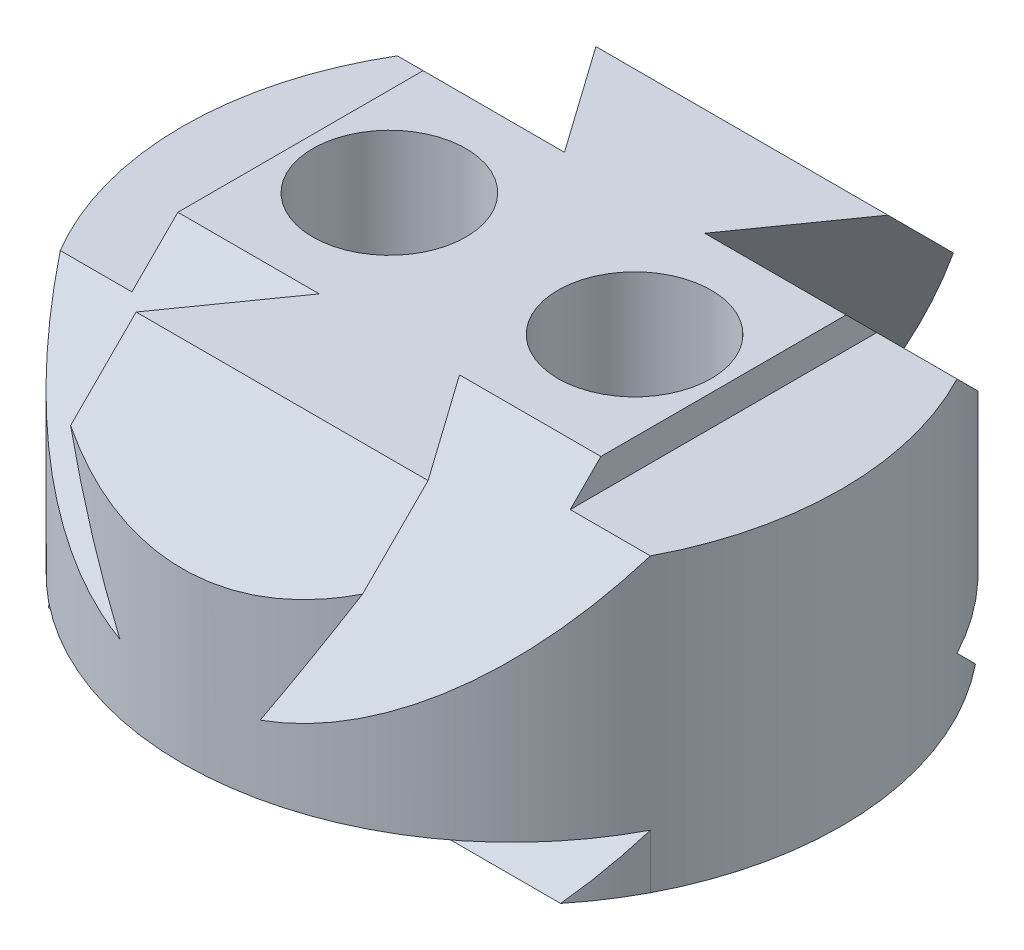
from build123d import *

# Parameters (mm, degrees)
SKETCH1_R                             = 21.5
BOSS_EXTRUDE1_DEPTH                   = 4
SKETCH2_R                             = 5.875
BOSS_EXTRUDE2_DEPTH                   = 65
BOSS_EXTRUDE3_REACH                   = 73.76
BOSS_EXTRUDE3_END_RADIUS              = 21.5
BOSS_EXTRUDE3_DIRECTION_2_REACH       = 73.76
BOSS_EXTRUDE3_DIRECTION_2_END_RADIUS  = 21.5
BOSS_EXTRUDE12_REACH                  = 71.147
BOSS_EXTRUDE12_END_RADIUS             = 21.5
BOSS_EXTRUDE13_REACH                  = 71.147
BOSS_EXTRUDE13_END_RADIUS             = 21.5
CUT_EXTRUDE3_DEPTH                    = 10
CUT_EXTRUDE3_DEPTH_BACK               = 2
SKETCH14_OUTSIDE_W                    = 63.394
SKETCH14_OUTSIDE_H                    = 63.394
SKETCH14_OUTSIDE_R                    = 5.875
SKETCH29_R                            = 7.508109265
CUT_EXTRUDE9_DEPTH                    = 51.5
SKETCH30_R                            = 5
CUT_EXTRUDE10_DEPTH                   = 9.8
CUT_EXTRUDE13_DEPTH                   = 38.426594822
CUT_EXTRUDE13_DEPTH_BACK              = 38.426594822
SKETCH31_W                            = 7.7
SKETCH31_H                            = 2
SKETCH31_H_2                          = 3
BOSS_EXTRUDE14_REACH                  = 35.268
BOSS_EXTRUDE14_END_RADIUS             = 21.5
BOSS_EXTRUDE14_DIRECTION_2_REACH      = 35.268
BOSS_EXTRUDE14_DIRECTION_2_END_RADIUS = 21.5
CUT_EXTRUDE14_START                   = -3
SKETCH36_R                            = 5
CUT_EXTRUDE14_DEPTH                   = 3
CUT_EXTRUDE15_REACH                   = 37.352
SKETCH38_R                            = 1.8923


with BuildPart() as part:
    # Sketch1 → Boss-Extrude1 (new body)
    with BuildSketch(Plane(origin=(0, 0, 0), x_dir=(1, 0, 0), z_dir=(0, 1, 0))):
        with Locations(Location((0, 0, 0), (0, 0, 270))):
            Circle(SKETCH1_R)
    extrude(amount=-BOSS_EXTRUDE1_DEPTH)

    # Sketch2 → Boss-Extrude2 (add)
    with BuildSketch(Plane(origin=(0, 0, 0), x_dir=(1, 0, 0), z_dir=(0, 1, 0))):
        with Locations(Location((0, 0, 0), (0, 0, 270))):
            Circle(SKETCH2_R)
    extrude(amount=BOSS_EXTRUDE2_DEPTH)

    # Boss-Extrude3: up to this cylinder (the profile starts inside it)
    boss_extrude3_end = Plane(origin=(0, 6.293939, 0), z_dir=(0, 1, 0)) * Cylinder(BOSS_EXTRUDE3_END_RADIUS, 191.52, mode=Mode.PRIVATE)
    # Sketch5 → Boss-Extrude3 (add, up to the surface)
    with BuildSketch(Plane(origin=(0, 0, 0), x_dir=(0, 0, -1), z_dir=(1, 0, 0)), mode=Mode.PRIVATE) as boss_extrude3_sk1:
        Polygon((21.5, 0), (0, 0), (-21.5, 0), (-6, 15.5), (6, 15.5), align=None)
    boss_extrude3_tool1 = extrude(boss_extrude3_sk1.sketch, amount=BOSS_EXTRUDE3_REACH, mode=Mode.PRIVATE) & boss_extrude3_end
    add(boss_extrude3_tool1.solids().sort_by_distance((0, 6.293939, 0))[0])

    # Boss-Extrude3 direction 2: up to this cylinder (the profile starts inside it)
    boss_extrude3_direction_2_end = Plane(origin=(0, 6.293939, 0), z_dir=(0, 1, 0)) * Cylinder(BOSS_EXTRUDE3_DIRECTION_2_END_RADIUS, 191.52, mode=Mode.PRIVATE)
    # Sketch5 → Boss-Extrude3 direction 2 (add, up to the surface)
    with BuildSketch(Plane(origin=(0, 0, 0), x_dir=(0, 0, -1), z_dir=(1, 0, 0)), mode=Mode.PRIVATE) as boss_extrude3_direction_2_sk1:
        Polygon((21.5, 0), (0, 0), (-21.5, 0), (-6, 15.5), (6, 15.5), align=None)
    boss_extrude3_direction_2_tool1 = extrude(boss_extrude3_direction_2_sk1.sketch, amount=-BOSS_EXTRUDE3_DIRECTION_2_REACH, mode=Mode.PRIVATE) & boss_extrude3_direction_2_end
    add(boss_extrude3_direction_2_tool1.solids().sort_by_distance((0, 6.293939, 0))[0])

    # Boss-Extrude12: up to this cylinder (the profile starts inside it)
    boss_extrude12_end = Plane(origin=(0, 17.454773, 0), z_dir=(0, 1, 0)) * Cylinder(BOSS_EXTRUDE12_END_RADIUS, 186.294, mode=Mode.PRIVATE)
    # Sketch6 → Boss-Extrude12 (add, up to the surface)
    with BuildSketch(Plane(origin=(0, 4.75, 4.75), x_dir=(-1, 0, 0), z_dir=(0, -0.7071067811865432, -0.7071067811865518)), mode=Mode.PRIVATE) as boss_extrude12_sk1:
        Polygon((0, 15.202795796), (4.575252532, 15.202795796), (9.525, 20.152543264), (0, 20.152543264), (-9.525, 20.152543264), (-4.575252532, 15.202795796), align=None)
    boss_extrude12_tool1 = extrude(boss_extrude12_sk1.sketch, amount=BOSS_EXTRUDE12_REACH, mode=Mode.PRIVATE) & boss_extrude12_end
    add(boss_extrude12_tool1.solids().sort_by_distance((0, 17.454773, -7.954773))[0])

    # Boss-Extrude13: up to this cylinder (the profile starts inside it)
    boss_extrude13_end = Plane(origin=(0, 17.454773, 0), z_dir=(0, 1, 0)) * Cylinder(BOSS_EXTRUDE13_END_RADIUS, 186.294, mode=Mode.PRIVATE)
    # Sketch10 → Boss-Extrude13 (add, up to the surface)
    with BuildSketch(Plane(origin=(0, 4.75, -4.75), x_dir=(-1, 0, 0), z_dir=(0, 0.7071067811865476, -0.7071067811865475)), mode=Mode.PRIVATE) as boss_extrude13_sk1:
        Polygon((0, 15.202795796), (-4.575252532, 15.202795796), (-9.525, 20.152543264), (0, 20.152543264), (9.525, 20.152543264), (4.575252532, 15.202795796), align=None)
    boss_extrude13_tool1 = extrude(boss_extrude13_sk1.sketch, amount=-BOSS_EXTRUDE13_REACH, mode=Mode.PRIVATE) & boss_extrude13_end
    add(boss_extrude13_tool1.solids().sort_by_distance((0, 17.454773, 7.954773))[0])

    # Sketch14 outside → Cut-Extrude3 (cut, two sides: drawn at the far end of the back side and taken through both)
    with BuildSketch(Plane(origin=(0, 15.5, 0), x_dir=(1, 0, 0), z_dir=(0, 1, 0)).offset(-CUT_EXTRUDE3_DEPTH_BACK)):
        Rectangle(SKETCH14_OUTSIDE_W, SKETCH14_OUTSIDE_H)
        with Locations(Location((0, 0, 0), (0, 0, 270))):
            Circle(SKETCH14_OUTSIDE_R, mode=Mode.SUBTRACT)
    extrude(amount=CUT_EXTRUDE3_DEPTH + CUT_EXTRUDE3_DEPTH_BACK, mode=Mode.SUBTRACT)

    # Sketch29 → Cut-Extrude9 (cut)
    with BuildSketch(Plane(origin=(0, 65, 0), x_dir=(1, 0, 0), z_dir=(0, 1, 0))):
        Circle(SKETCH29_R)
    extrude(amount=-CUT_EXTRUDE9_DEPTH, mode=Mode.SUBTRACT)

    # Sketch30 → Cut-Extrude10 (cut)
    with BuildSketch(Plane(origin=(0, 13.5, 0), x_dir=(1, 0, 0), z_dir=(0, 1, 0))):
        with Locations(Location((-8, 0, 0), (0, 0, 270))):
            Circle(SKETCH30_R)
        with Locations(Location((8, 0, 0), (0, 0, 270))):
            Circle(SKETCH30_R)
    extrude(amount=-CUT_EXTRUDE10_DEPTH, mode=Mode.SUBTRACT)

    # Sketch31 → Cut-Extrude13 (cut, two sides: drawn at the far end of the back side and taken through both)
    with BuildSketch(Plane.XY.offset(-6).offset(-CUT_EXTRUDE13_DEPTH_BACK)):
        with Locations((17.65, 12.5)):
            Rectangle(SKETCH31_W, SKETCH31_H)
        with Locations((-17.65, 12)):
            Rectangle(SKETCH31_W, SKETCH31_H_2)
    extrude(amount=CUT_EXTRUDE13_DEPTH + CUT_EXTRUDE13_DEPTH_BACK, mode=Mode.SUBTRACT)

    # Boss-Extrude14: up to this cylinder (the profile starts inside it)
    boss_extrude14_end = Plane(origin=(0, -5.856286, 0), z_dir=(0, 1, 0)) * Cylinder(BOSS_EXTRUDE14_END_RADIUS, 114.536, mode=Mode.PRIVATE)
    # Sketch34 → Boss-Extrude14 (add, up to the surface)
    with BuildSketch(Plane(origin=(0, 0, 0), x_dir=(0, 0, -1), z_dir=(1, 0, 0)), mode=Mode.PRIVATE) as boss_extrude14_sk1:
        Polygon((0, -4), (-10, -4), (-13.535533906, -7.535533906), (13.535533906, -7.535533906), (10, -4), align=None)
    boss_extrude14_tool1 = extrude(boss_extrude14_sk1.sketch, amount=BOSS_EXTRUDE14_REACH, mode=Mode.PRIVATE) & boss_extrude14_end
    add(boss_extrude14_tool1.solids().sort_by_distance((0, -5.856286, 0))[0])

    # Boss-Extrude14 direction 2: up to this cylinder (the profile starts inside it)
    boss_extrude14_direction_2_end = Plane(origin=(0, -5.856286, 0), z_dir=(0, 1, 0)) * Cylinder(BOSS_EXTRUDE14_DIRECTION_2_END_RADIUS, 114.536, mode=Mode.PRIVATE)
    # Sketch34 → Boss-Extrude14 direction 2 (add, up to the surface)
    with BuildSketch(Plane(origin=(0, 0, 0), x_dir=(0, 0, -1), z_dir=(1, 0, 0)), mode=Mode.PRIVATE) as boss_extrude14_direction_2_sk1:
        Polygon((0, -4), (-10, -4), (-13.535533906, -7.535533906), (13.535533906, -7.535533906), (10, -4), align=None)
    boss_extrude14_direction_2_tool1 = extrude(boss_extrude14_direction_2_sk1.sketch, amount=-BOSS_EXTRUDE14_DIRECTION_2_REACH, mode=Mode.PRIVATE) & boss_extrude14_direction_2_end
    add(boss_extrude14_direction_2_tool1.solids().sort_by_distance((0, -5.856286, 0))[0])

    # Sketch36 → Cut-Extrude14 (cut)
    with BuildSketch(Plane.XZ.offset(7.535533906).offset(CUT_EXTRUDE14_START)):
        with Locations(Location((-8, 0, 0), (0, 0, 90))):
            Circle(SKETCH36_R)
        with Locations(Location((8, 0, 0), (0, 0, 90))):
            Circle(SKETCH36_R)
    extrude(amount=CUT_EXTRUDE14_DEPTH, mode=Mode.SUBTRACT)

    # Sketch38 → Cut-Extrude15 (cut, up to next)
    with BuildSketch(Plane.XZ.offset(4.535533906), mode=Mode.PRIVATE) as cut_extrude15_sk1:
        with Locations(Location((-8, 0, 0), (0, 0, 270))):
            Circle(SKETCH38_R)
    cut_extrude15_tool1 = extrude(cut_extrude15_sk1.sketch, amount=-CUT_EXTRUDE15_REACH, mode=Mode.PRIVATE) & part.part
    # Sketch38 → Cut-Extrude15 (cut, up to next)
    with BuildSketch(Plane.XZ.offset(4.535533906), mode=Mode.PRIVATE) as cut_extrude15_sk2:
        with Locations(Location((8, 0, 0), (0, 0, 270))):
            Circle(SKETCH38_R)
    cut_extrude15_tool2 = extrude(cut_extrude15_sk2.sketch, amount=-CUT_EXTRUDE15_REACH, mode=Mode.PRIVATE) & part.part
    add(cut_extrude15_tool1.solids().sort_by_distance((-8, -4.535534, 0))[0], mode=Mode.SUBTRACT)
    add(cut_extrude15_tool2.solids().sort_by_distance((8, -4.535534, 0))[0], mode=Mode.SUBTRACT)


solid = part.part
